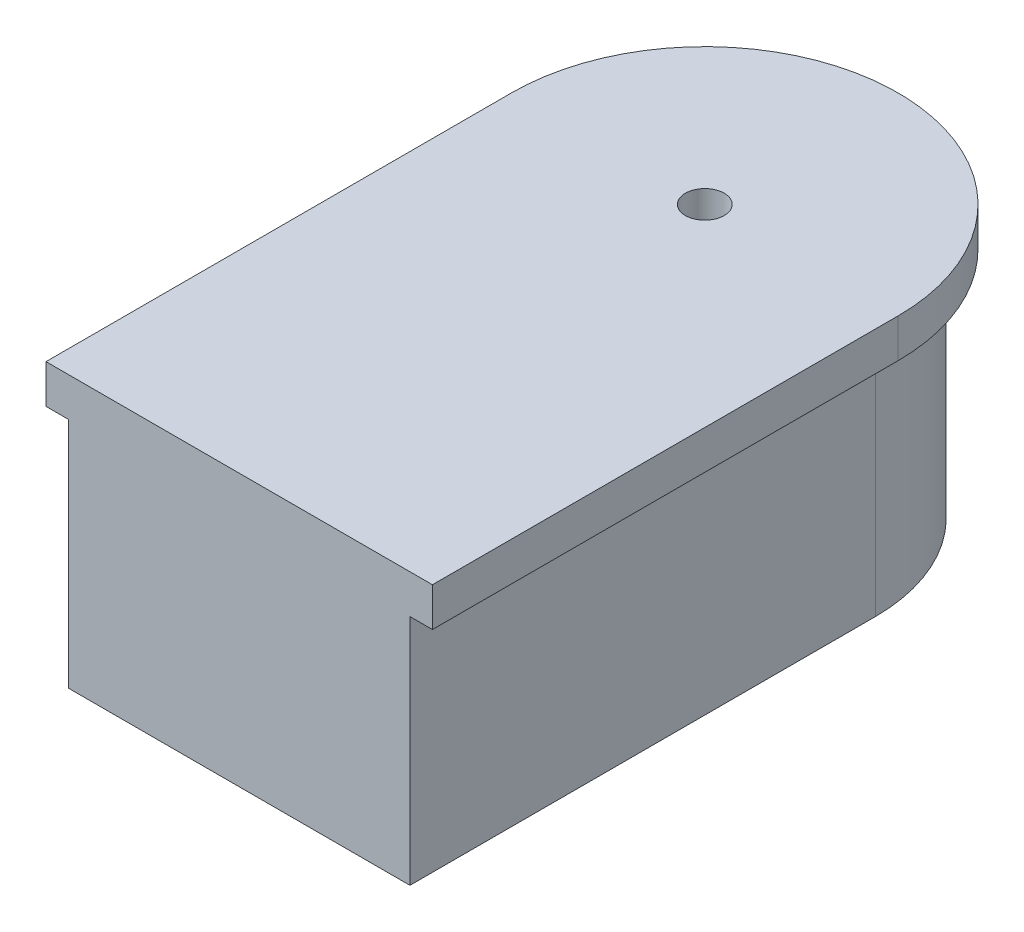
from build123d import *

# Parameters (mm, degrees)
BOSS_EXTRUDE1_DEPTH = 30
BOSS_EXTRUDE2_DEPTH = 5
SKETCH3_R           = 2.5
CUT_EXTRUDE1_DEPTH  = 104.114596445


with BuildPart() as part:
    # Sketch1 → Boss-Extrude1 (new body)
    with BuildSketch(Plane(origin=(0, 0, 0), x_dir=(1, 0, 0), z_dir=(0, 1, 0))):
        with BuildLine():
            Line((0, 0), (44, 0))
            Line((44, 0), (44, 60))
            ThreePointArc((44, 60), (22, 82), (0, 60))
            Line((0, 60), (0, 0))
        make_face()
    extrude(amount=BOSS_EXTRUDE1_DEPTH)

    # Sketch2 → Boss-Extrude2 (add)
    with BuildSketch(Plane(origin=(0, 30, 0), x_dir=(1, 0, 0), z_dir=(0, 1, 0))):
        with BuildLine():
            Line((46.9, 0), (-2.9, 0))
            Line((-2.9, 0), (-2.9, 60))
            ThreePointArc((-2.9, 60), (22, 84.9), (46.9, 60))
            Line((46.9, 60), (46.9, 0))
        make_face()
    extrude(amount=BOSS_EXTRUDE2_DEPTH)

    # Sketch3 → Cut-Extrude1 (cut, through all)
    with BuildSketch(Plane(origin=(0, 35, 0), x_dir=(1, 0, 0), z_dir=(0, 1, 0))):
        with Locations(Location((22, 60, 0), (0, 0, 270))):
            Circle(SKETCH3_R)
    extrude(amount=-CUT_EXTRUDE1_DEPTH, mode=Mode.SUBTRACT)


solid = part.part
